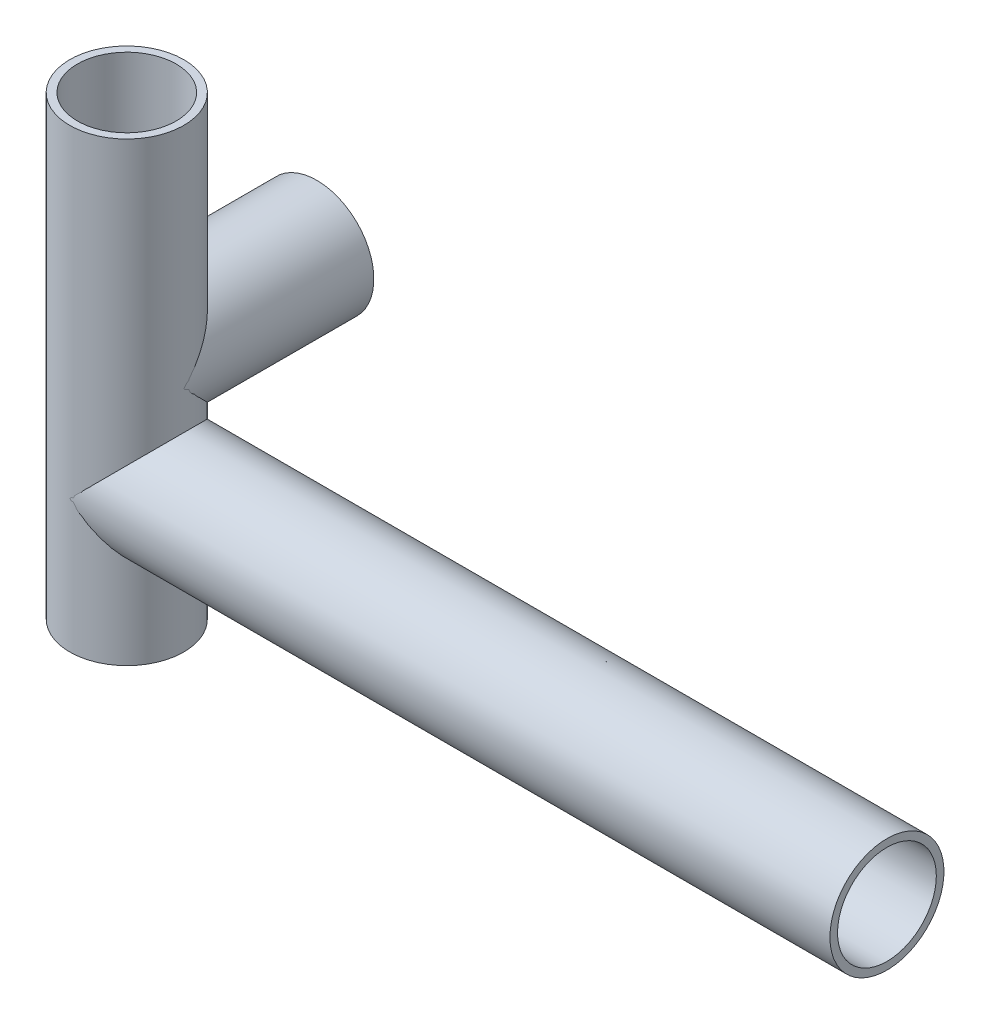
from build123d import *

# Parameters (mm, degrees)
SWEEP_THIN6_PROFILE_R   = 15
SWEEP_THIN6_PROFILE_R_2 = 13
SWEEP_THIN8_PROFILE_R   = 15
SWEEP_THIN8_PROFILE_R_2 = 13
CUT_EXTRUDE1_START      = -185
SKETCH135_R             = 15
CUT_EXTRUDE1_DEPTH      = 185
SWEEP_THIN9_PROFILE_R   = 15
SWEEP_THIN9_PROFILE_R_2 = 13
SKETCH183_R             = 15
CUT_EXTRUDE2_DEPTH      = 239.537208858


with BuildPart() as part:
    # Sweep-Thin6: sweep along a path in Sketch1
    with BuildLine(Plane(origin=(0, 0, 0), x_dir=(0, 0, -1), z_dir=(1, 0, 0))) as sweep_thin6_path:
        Line((0, 118.321595662), (0, -1.678404338))
    # Sweep-Thin6 profile (on start of the path) → Sweep-Thin6 (sweep)
    with BuildSketch(Plane(origin=(0, 118.321595662, 0), x_dir=(0, 0, -1), z_dir=(0, -1, 0))):
        Circle(SWEEP_THIN6_PROFILE_R)
        Circle(SWEEP_THIN6_PROFILE_R_2, mode=Mode.SUBTRACT)
    sweep(path=sweep_thin6_path.line)


with BuildPart() as body_2:
    # Sweep-Thin8: sweep along a path in Sketch66
    with BuildLine(Plane(origin=(0, 0, 0), x_dir=(0, 0, -1), z_dir=(1, 0, 0))) as sweep_thin8_path:
        Line((0, 58.321595662), (50, 58.321595662))
    # Sweep-Thin8 profile (on start of the path) → Sweep-Thin8 (sweep)
    with BuildSketch(Plane(origin=(0, 58.321595662, 0), x_dir=(-1, 0, 0), z_dir=(0, 0, -1))):
        Circle(SWEEP_THIN8_PROFILE_R)
        Circle(SWEEP_THIN8_PROFILE_R_2, mode=Mode.SUBTRACT)
    sweep(path=sweep_thin8_path.line)

    # Sketch135 → Cut-Extrude1 (cut)
    with BuildSketch(Plane(origin=(0, 118.321595662, 0), x_dir=(1, 0, 0), z_dir=(0, 1, 0)).offset(CUT_EXTRUDE1_START)):
        Circle(SKETCH135_R)
    extrude(amount=CUT_EXTRUDE1_DEPTH, mode=Mode.SUBTRACT)


with BuildPart() as body_3:
    # Sweep-Thin9: sweep along a path in Sketch142
    with BuildLine(Plane.XY) as sweep_thin9_path:
        Line((0, 58.321595662), (0, 33.321595662))
        Line((0, 33.321595662), (200, 33.321595662))
    # Sweep-Thin9 profile (on start of the path) → Sweep-Thin9 (sweep)
    with BuildSketch(Plane(origin=(0, 58.321595662, 0), x_dir=(-1, 0, 0), z_dir=(0, -1, 0))):
        Circle(SWEEP_THIN9_PROFILE_R)
        Circle(SWEEP_THIN9_PROFILE_R_2, mode=Mode.SUBTRACT)
    sweep(path=sweep_thin9_path.line, transition=Transition.RIGHT)

    # Sketch183 → Cut-Extrude2 (cut, through all)
    with BuildSketch(Plane(origin=(0, 118.321595662, 0), x_dir=(1, 0, 0), z_dir=(0, 1, 0))):
        Circle(SKETCH183_R)
    extrude(amount=-CUT_EXTRUDE2_DEPTH, mode=Mode.SUBTRACT)


solid = Compound([part.part, body_2.part, body_3.part])
